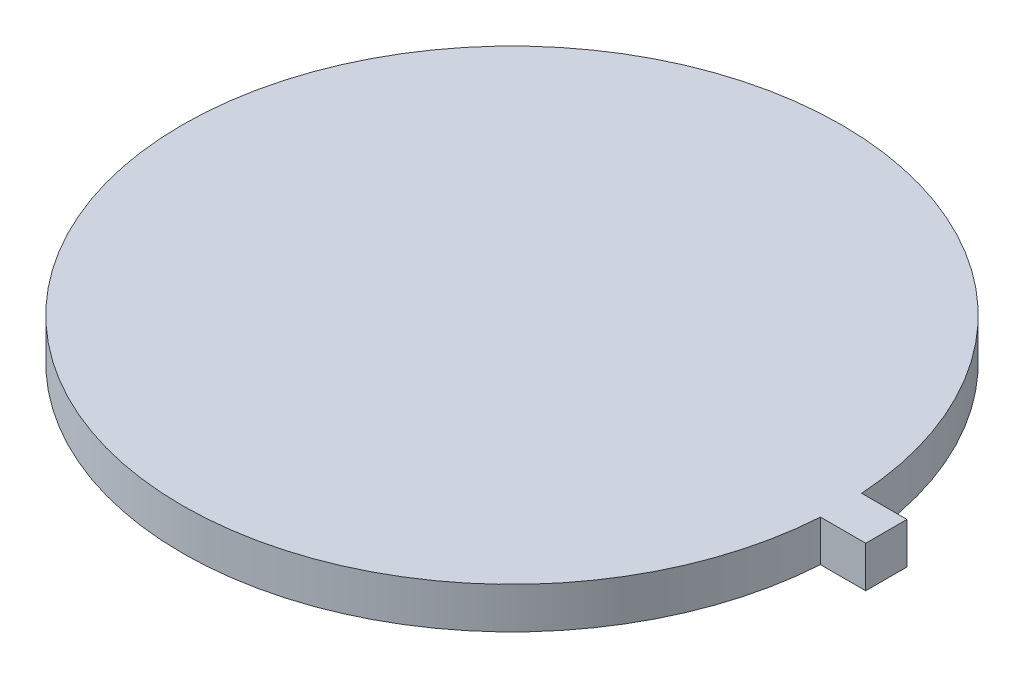
from build123d import *

# Parameters (mm, degrees)
BOSS_EXTRUDE2_DEPTH = 12.7


with BuildPart() as part:
    # Sketch1 → Boss-Extrude2 (new body)
    with BuildSketch(Plane(origin=(0, 0, 0), x_dir=(1, 0, 0), z_dir=(0, 1, 0))):
        with BuildLine():
            Line((115.371368334, -3.175), (115.371368334, 6.35))
            Line((115.371368334, 6.35), (101.401368334, 6.35))
            ThreePointArc((101.401368334, 6.35), (-101.6, 0), (101.401368334, -6.35))
            Line((101.401368334, -6.35), (115.371368334, -6.35))
            Line((115.371368334, -6.35), (115.371368334, -3.175))
        make_face()
    extrude(amount=BOSS_EXTRUDE2_DEPTH)


solid = part.part
